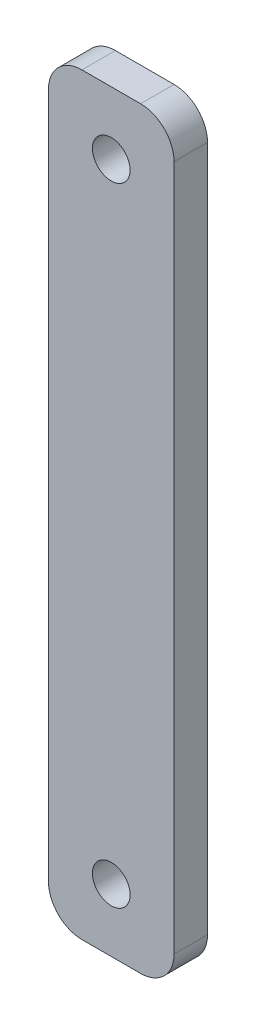
from build123d import *

# Parameters (mm, degrees)
SKETCH1_R           = 2.25
BOSS_EXTRUDE2_DEPTH = 4


with BuildPart() as part:
    # Sketch1 → Boss-Extrude2 (new body)
    with BuildSketch(Plane.XY):
        with BuildLine():
            Line((-3.5, 45), (3.5, 45))
            ThreePointArc((3.5, 45), (6.328427125, 43.828427125), (7.5, 41))
            Line((7.5, 41), (7.5, -41))
            ThreePointArc((7.5, -41), (6.328427125, -43.828427125), (3.5, -45))
            Line((3.5, -45), (-3.5, -45))
            ThreePointArc((-3.5, -45), (-6.328427125, -43.828427125), (-7.5, -41))
            Line((-7.5, -41), (-7.5, 41))
            ThreePointArc((-7.5, 41), (-6.328427125, 43.828427125), (-3.5, 45))
        make_face()
        with Locations((0, 37.5)):
            Circle(SKETCH1_R, mode=Mode.SUBTRACT)
        with Locations(Location((0, -37.5, 0), (0, 0, 180))):
            Circle(SKETCH1_R, mode=Mode.SUBTRACT)
    extrude(amount=BOSS_EXTRUDE2_DEPTH)


solid = part.part
